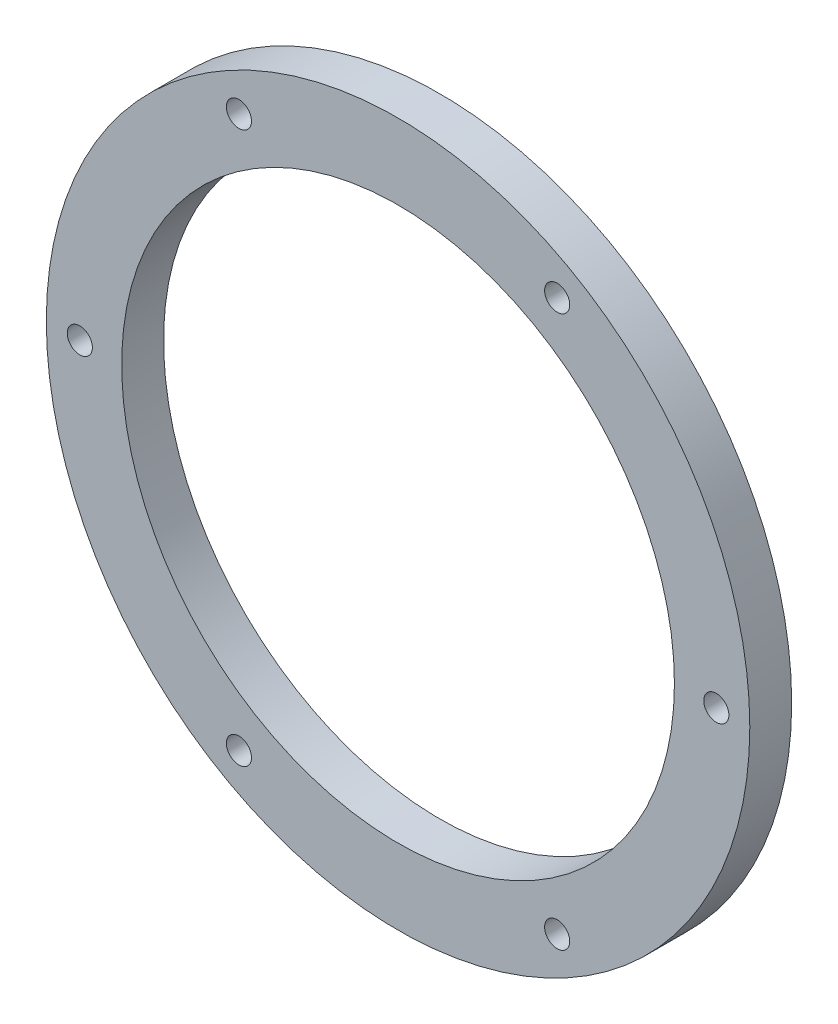
from build123d import *

# Parameters (mm, degrees)
SKETCH1_R           = 42
SKETCH1_R_2         = 33
BOSS_EXTRUDE1_DEPTH = 5
SKETCH2_R           = 1.5
CUT_EXTRUDE1_DEPTH  = 11


with BuildPart() as part:
    # Sketch1 → Boss-Extrude1 (new body)
    with BuildSketch(Plane.XY):
        Circle(SKETCH1_R)
        Circle(SKETCH1_R_2, mode=Mode.SUBTRACT)
    extrude(amount=BOSS_EXTRUDE1_DEPTH)

    # Sketch2 → Cut-Extrude1 (cut)
    with BuildSketch(Plane(origin=(0, 0, 0), x_dir=(-1, 0, 0), z_dir=(0, 0, -1))):
        with Locations((-19, 32.908965344)):
            Circle(SKETCH2_R)
        with Locations((19, 32.908965344)):
            Circle(SKETCH2_R)
        with Locations((38, 0)):
            Circle(SKETCH2_R)
        with Locations((19, -32.908965344)):
            Circle(SKETCH2_R)
        with Locations((-19, -32.908965344)):
            Circle(SKETCH2_R)
        with Locations((-38, 0)):
            Circle(SKETCH2_R)
    extrude(amount=-CUT_EXTRUDE1_DEPTH, mode=Mode.SUBTRACT)


solid = part.part
